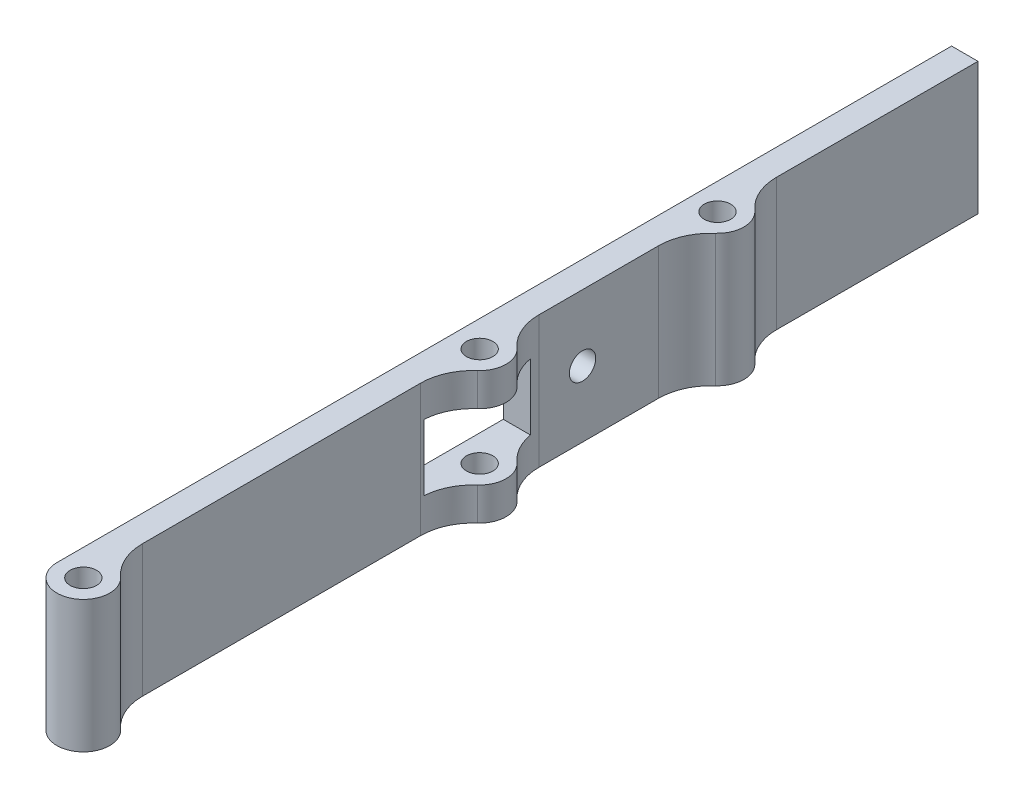
from build123d import *

# Parameters (mm, degrees)
SKETCH2_R           = 2.5
BOSS_EXTRUDE1_DEPTH = 25
SKETCH3_R           = 1
CUT_EXTRUDE1_DEPTH  = 25
SKETCH6_R           = 2.5
SKETCH6_W           = 20
SKETCH6_H           = 12.5
CUT_EXTRUDE2_DEPTH  = 144.01010212


with BuildPart() as part:
    # Sketch2 → Boss-Extrude1 (new body)
    with BuildSketch(Plane(origin=(0, 0, 0), x_dir=(1, 0, 0), z_dir=(0, 1, 0))):
        with BuildLine():
            Line((0.030237901, 33.847554993), (0.030237901, -135.452445007))
            ThreePointArc((0.030237901, -135.452445007), (7.071479353, -140.016799653), (8.363571234, -131.725665044))
            ThreePointArc((8.363571234, -131.725665044), (5.901528609, -128.354588024), (5.030237901, -124.272105119))
            Line((5.030237901, -124.272105119), (5.030237901, -71.632784894))
            ThreePointArc((5.030237901, -71.632784894), (5.901528609, -67.55030199), (8.363571234, -64.179224969))
            ThreePointArc((8.363571234, -64.179224969), (10.030237901, -60.452445007), (8.363571234, -56.725665044))
            ThreePointArc((8.363571234, -56.725665044), (5.901528609, -53.354588024), (5.030237901, -49.272105119))
            Line((5.030237901, -49.272105119), (5.030237901, -26.632784894))
            ThreePointArc((5.030237901, -26.632784894), (5.901528609, -22.55030199), (8.363571234, -19.179224969))
            ThreePointArc((8.363571234, -19.179224969), (10.030214165, -15.437038677), (8.340541648, -11.705194134))
            ThreePointArc((8.340541648, -11.705194134), (5.841334205, -8.313005826), (4.961165626, -4.192534659))
            Line((4.961165626, -4.192534659), (5.030237901, 33.847554993))
            Line((5.030237901, 33.847554993), (0.030237901, 33.847554993))
        make_face()
        with Locations(Location((5.030237901, -15.452445007, 0), (0, 0, 270))):
            Circle(SKETCH2_R, mode=Mode.SUBTRACT)
        with Locations(Location((5.030237901, -135.452445007, 0), (0, 0, 270))):
            Circle(SKETCH2_R, mode=Mode.SUBTRACT)
        with Locations(Location((5.030237901, -60.452445007, 0), (0, 0, 270))):
            Circle(SKETCH2_R, mode=Mode.SUBTRACT)
    extrude(amount=BOSS_EXTRUDE1_DEPTH)

    # Sketch3 → Cut-Extrude1 (cut)
    with BuildSketch(Plane(origin=(0, 0, -33.847554993), x_dir=(-1, 0, 0), z_dir=(0, 0, -1))):
        with Locations((-2.5, 15)):
            Circle(SKETCH3_R)
        with Locations((-2.5, 5)):
            Circle(SKETCH3_R)
    extrude(amount=-CUT_EXTRUDE1_DEPTH, mode=Mode.SUBTRACT)

    # Sketch6 → Cut-Extrude2 (cut, through all)
    with BuildSketch(Plane.ZY.offset(-0.030237901)):
        with Locations((40.98910992, 12.5)):
            Circle(SKETCH6_R)
        with Locations((60.98910992, 12.5)):
            Rectangle(SKETCH6_W, SKETCH6_H)
    extrude(amount=-CUT_EXTRUDE2_DEPTH, mode=Mode.SUBTRACT)


solid = part.part
